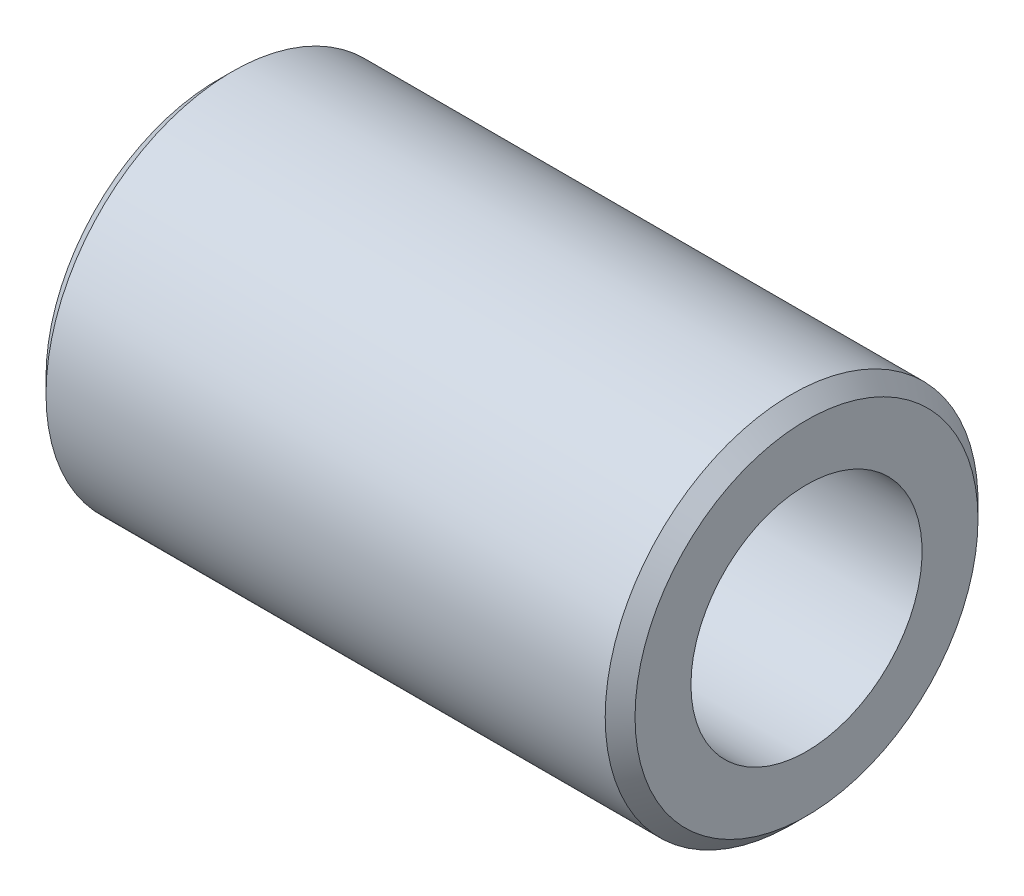
from build123d import *


with BuildPart() as part:
    # Esboço1 → Revolução1 (revolve)
    with BuildSketch(Plane.XY, mode=Mode.PRIVATE) as revolu_o1_sk:
        Polygon((-39.5, 23), (-37.5, 25), (37.5, 25), (39.5, 23), (39.5, 15.5), (-39.5, 15.5), align=None)
    revolve(revolu_o1_sk.sketch.rotate(Axis((-39.5, 0, 0), (1, 0, 0)), 90), axis=Axis((-39.5, 0, 0), (1, 0, 0)))


solid = part.part
